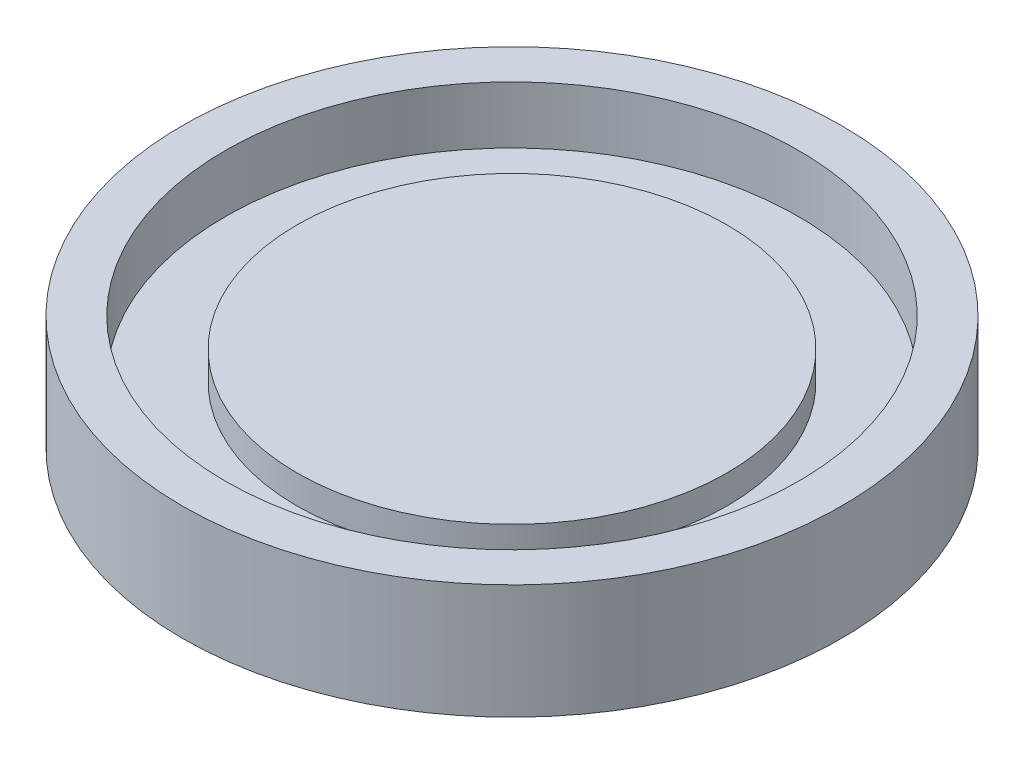
from build123d import *

# Parameters (mm, degrees)
SKETCH2_R           = 14.605
BOSS_EXTRUDE2_DEPTH = 2.54
SKETCH3_R           = 14.605
SKETCH3_R_2         = 12.7
BOSS_EXTRUDE3_DEPTH = 2.54
SKETCH4_R           = 9.525
BOSS_EXTRUDE4_DEPTH = 1.27


with BuildPart() as part:
    # Sketch2 → Boss-Extrude2 (new body)
    with BuildSketch(Plane(origin=(0, 0, 0), x_dir=(1, 0, 0), z_dir=(0, 1, 0))):
        with Locations(Location((0, 0, 0), (0, 0, 270))):
            Circle(SKETCH2_R)
    extrude(amount=BOSS_EXTRUDE2_DEPTH)

    # Sketch3 → Boss-Extrude3 (add)
    with BuildSketch(Plane(origin=(0, 2.54, 0), x_dir=(1, 0, 0), z_dir=(0, 1, 0))):
        with Locations(Location((0, 0, 0), (0, 0, 270))):
            Circle(SKETCH3_R)
        with Locations(Location((0, 0, 0), (0, 0, 270))):
            Circle(SKETCH3_R_2, mode=Mode.SUBTRACT)
    extrude(amount=BOSS_EXTRUDE3_DEPTH)

    # Sketch4 → Boss-Extrude4 (add)
    with BuildSketch(Plane(origin=(0, 2.54, 0), x_dir=(1, 0, 0), z_dir=(0, 1, 0))):
        with Locations(Location((0, 0, 0), (0, 0, 270))):
            Circle(SKETCH4_R)
    extrude(amount=BOSS_EXTRUDE4_DEPTH)


solid = part.part
